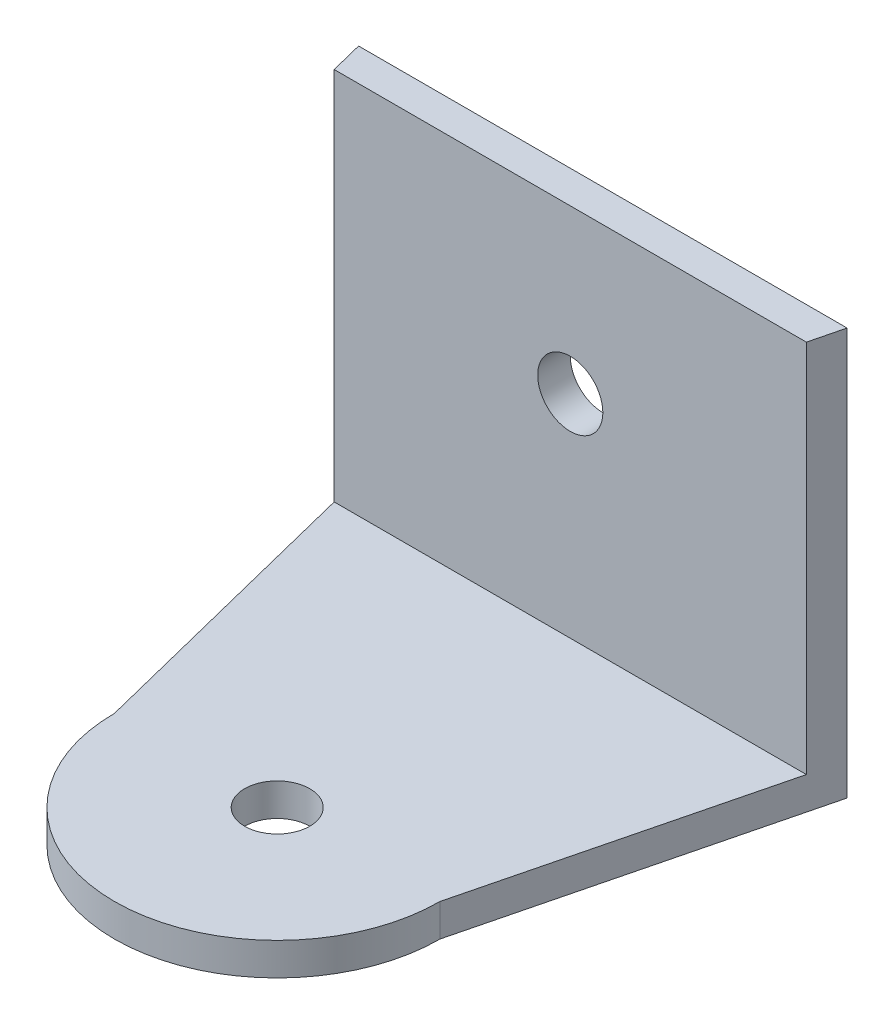
from build123d import *

# Parameters (mm, degrees)
SKETCH1_W           = 30
SKETCH1_H           = 25
BOSS_EXTRUDE1_DEPTH = 2
SKETCH2_R           = 2
CUT_EXTRUDE1_DEPTH  = 2
SKETCH3_W           = 30
SKETCH3_H           = 2
BOSS_EXTRUDE3_DEPTH = 28
SKETCH4_R           = 2
CUT_EXTRUDE2_DEPTH  = 42.833001327


with BuildPart() as part:
    # Sketch1 → Boss-Extrude1 (new body)
    with BuildSketch(Plane.XY):
        Rectangle(SKETCH1_W, SKETCH1_H)
    extrude(amount=BOSS_EXTRUDE1_DEPTH)

    # Sketch2 → Cut-Extrude1 (cut)
    with BuildSketch(Plane.XY.offset(2)):
        with Locations((0, 2.5)):
            Circle(SKETCH2_R)
    extrude(amount=-CUT_EXTRUDE1_DEPTH, mode=Mode.SUBTRACT)

    # Sketch3 → Boss-Extrude3 (add)
    with BuildSketch(Plane.XY.offset(2)):
        with Locations((0, -11.5)):
            Rectangle(SKETCH3_W, SKETCH3_H)
    extrude(amount=BOSS_EXTRUDE3_DEPTH)

    # Sketch4 → Cut-Extrude2 (cut, through all)
    with BuildSketch(Plane.XZ.offset(12.5)):
        with Locations(Location((0, 20, 0), (0, 0, 270))):
            Circle(SKETCH4_R)
        with BuildLine():
            Line((-15, 30), (-15, 0))
            Line((-15, 0), (-10, 20))
            ThreePointArc((-10, 20), (-7.071067812, 27.071067812), (0, 30))
            Line((0, 30), (-15, 30))
        make_face()
        with BuildLine():
            Line((15, 30), (0, 30))
            ThreePointArc((0, 30), (7.071067812, 27.071067812), (10, 20))
            Line((10, 20), (15, 0))
            Line((15, 0), (15, 30))
        make_face()
    extrude(amount=-CUT_EXTRUDE2_DEPTH, mode=Mode.SUBTRACT)


solid = part.part
